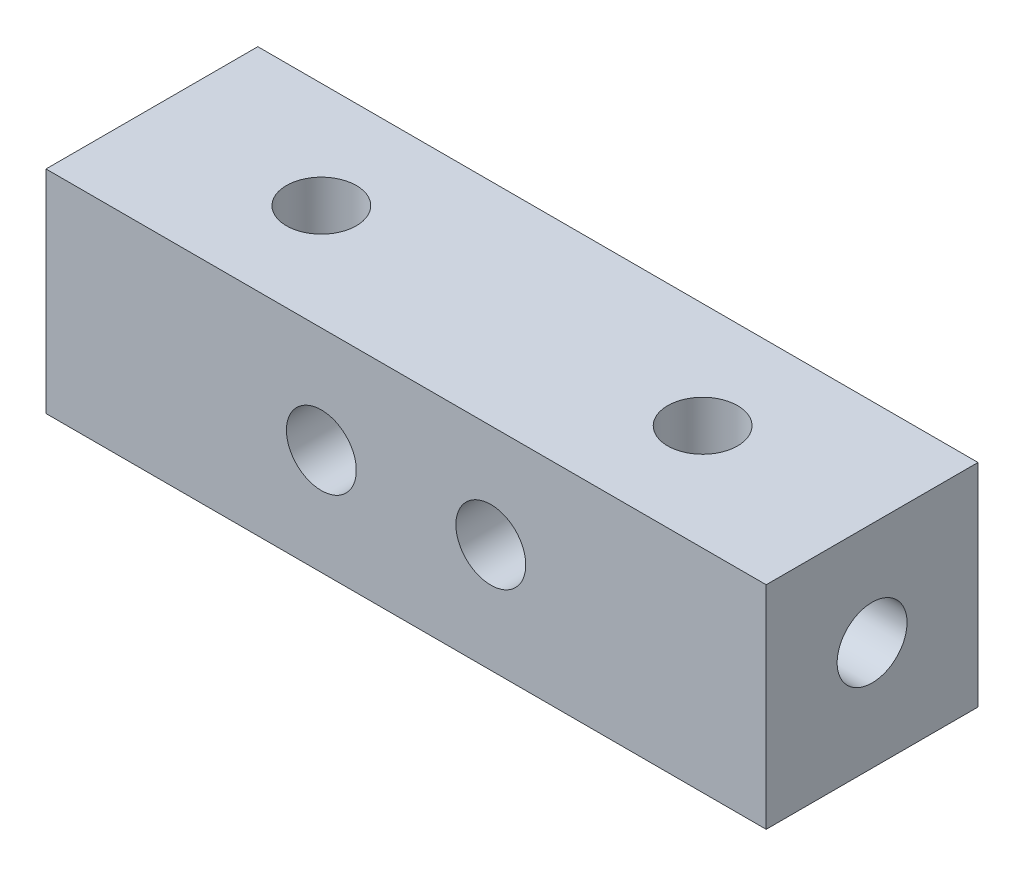
from build123d import *

# Parameters (mm, degrees)
SKETCH_3_W         = 34
SKETCH_3_H         = 10
EXTRUDE_2_DEPTH    = 10
HOLE_WIZARD_M4_1_D = 3.3
HOLE_WIZARD_M4_2_D = 3.3
HOLE_WIZARD_M4_3_D = 3.3
HOLE_WIZARD_M4_4_D = 3.3
HOLE_WIZARD_M4_5_D = 3.3


with BuildPart() as part:
    # 草图3 → 凸台-拉伸2 (new body)
    with BuildSketch(Plane.XY):
        Rectangle(SKETCH_3_W, SKETCH_3_H)
    extrude(amount=EXTRUDE_2_DEPTH)

    # M4 螺纹孔的螺纹孔钻头1 (through all)
    with Locations(Plane(origin=(17, 0.134296894, 5), x_dir=(0, 0, 1), z_dir=(1, 0, 0))):
        with Locations((0, 0)):
            Hole(HOLE_WIZARD_M4_1_D / 2)

    # M4 螺纹孔的螺纹孔钻头2 (through all)
    with Locations(Plane(origin=(9, -5, 5), x_dir=(-1, 0, 0), z_dir=(0, -1, 0))):
        with Locations((0, 0)):
            Hole(HOLE_WIZARD_M4_2_D / 2)

    # M4 螺纹孔的螺纹孔钻头3 (through all)
    with Locations(Plane(origin=(-9, -5, 5), x_dir=(-1, 0, 0), z_dir=(0, -1, 0))):
        with Locations((0, 0)):
            Hole(HOLE_WIZARD_M4_3_D / 2)

    # M4 螺纹孔的螺纹孔钻头4 (through all)
    with Locations(Plane(origin=(4, 0.134296894, 0), x_dir=(-1, 0, 0), z_dir=(0, 0, -1))):
        with Locations((0, 0)):
            Hole(HOLE_WIZARD_M4_4_D / 2)

    # M4 螺纹孔的螺纹孔钻头5 (through all)
    with Locations(Plane(origin=(-4, 0, 0), x_dir=(-1, 0, 0), z_dir=(0, 0, -1))):
        with Locations((0, 0)):
            Hole(HOLE_WIZARD_M4_5_D / 2)


solid = part.part
